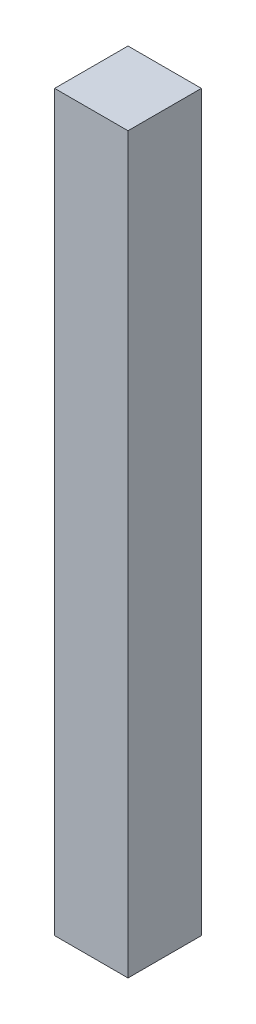
from build123d import *

# Parameters (mm, degrees)
ESQUISSE1_W        = 5
ESQUISSE1_H        = 50
BOSS_EXTRU_1_DEPTH = 5


with BuildPart() as part:
    # Esquisse1 → Boss.-Extru.1 (new body)
    with BuildSketch(Plane.XY):
        with Locations((-2.5, -25)):
            Rectangle(ESQUISSE1_W, ESQUISSE1_H)
    extrude(amount=BOSS_EXTRU_1_DEPTH)


solid = part.part
